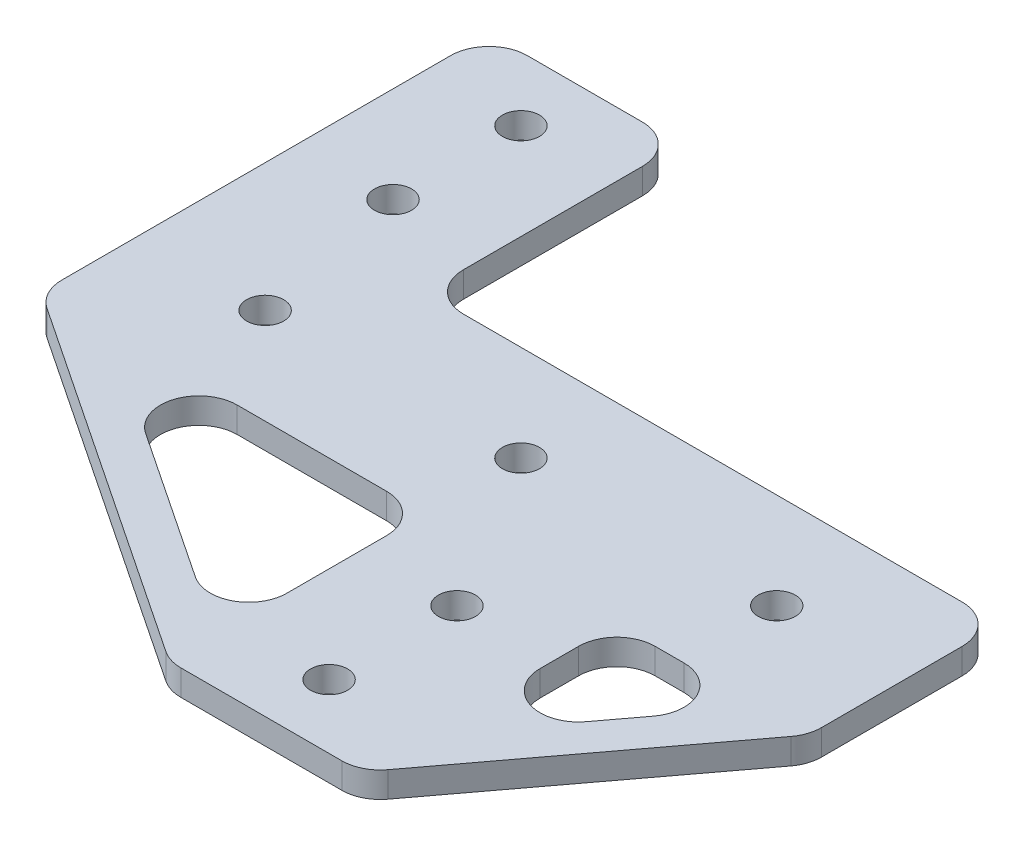
from build123d import *

# Parameters (mm, degrees)
SKETCH_1_R          = 1.45
EXTRUDE_1_DEPTH     = 2
CUT_EXTRUDE_1_DEPTH = 70.491006612
FILLET_1_R          = 3


with BuildPart() as part:
    # 草图1 → 凸台-拉伸1 (new body)
    with BuildSketch(Plane(origin=(0, 0, 0), x_dir=(1, 0, 0), z_dir=(0, 1, 0))):
        Polygon((0, 15), (0, 0), (30, -20), (45, -20), (60, 0), (60, 15), (45, 15), (32, 15), (15, 35), (0, 35), align=None)
        Polygon((30, -16.394448725), (5.408326913, 0), (30, 0), align=None, mode=Mode.SUBTRACT)
        with Locations(Location((37.5, -15, 0), (0, 0, 270))):
            Circle(SKETCH_1_R, mode=Mode.SUBTRACT)
        Polygon((45, 0), (56.25, 0), (45, -15), align=None, mode=Mode.SUBTRACT)
        with Locations(Location((37.5, -5, 0), (0, 0, 270))):
            Circle(SKETCH_1_R, mode=Mode.SUBTRACT)
        with Locations(Location((10, 7.5, 0), (0, 0, 270))):
            Circle(SKETCH_1_R, mode=Mode.SUBTRACT)
        with Locations(Location((7.5, 20, 0), (0, 0, 270))):
            Circle(SKETCH_1_R, mode=Mode.SUBTRACT)
        with Locations(Location((7.5, 30, 0), (0, 0, 270))):
            Circle(SKETCH_1_R, mode=Mode.SUBTRACT)
        Polygon((15, 28.82380953), (26.750238101, 15), (15, 15), align=None, mode=Mode.SUBTRACT)
        with Locations(Location((30, 7.5, 0), (0, 0, 270))):
            Circle(SKETCH_1_R, mode=Mode.SUBTRACT)
        with Locations(Location((50, 7.5, 0), (0, 0, 270))):
            Circle(SKETCH_1_R, mode=Mode.SUBTRACT)
    extrude(amount=EXTRUDE_1_DEPTH)

    # 草图2 → 切除-拉伸1 (cut, through all)
    with BuildSketch(Plane(origin=(0, 2, 0), x_dir=(1, 0, 0), z_dir=(0, 1, 0))):
        Polygon((15, 35), (15, 15), (32, 15), align=None)
    extrude(amount=-CUT_EXTRUDE_1_DEPTH, mode=Mode.SUBTRACT)

    # 圆角1
    fillet_1_edges = [part.edges().sort_by_distance(p)[0] for p in [
        (15, 1, -15),
        (45, 1, 15),
        (56.25, 1, 0),
        (45, 1, 0),
        (30, 1, 0),
        (5.408326913, 1, 0),
        (30, 1, 16.394448725),
        (60, 1, -15),
        (60, 1, 0),
        (45, 1, 20),
        (30, 1, 20),
        (0, 1, 0),
        (0, 1, -35),
        (15, 1, -35),
    ]]
    fillet(fillet_1_edges, radius=FILLET_1_R)


solid = part.part
